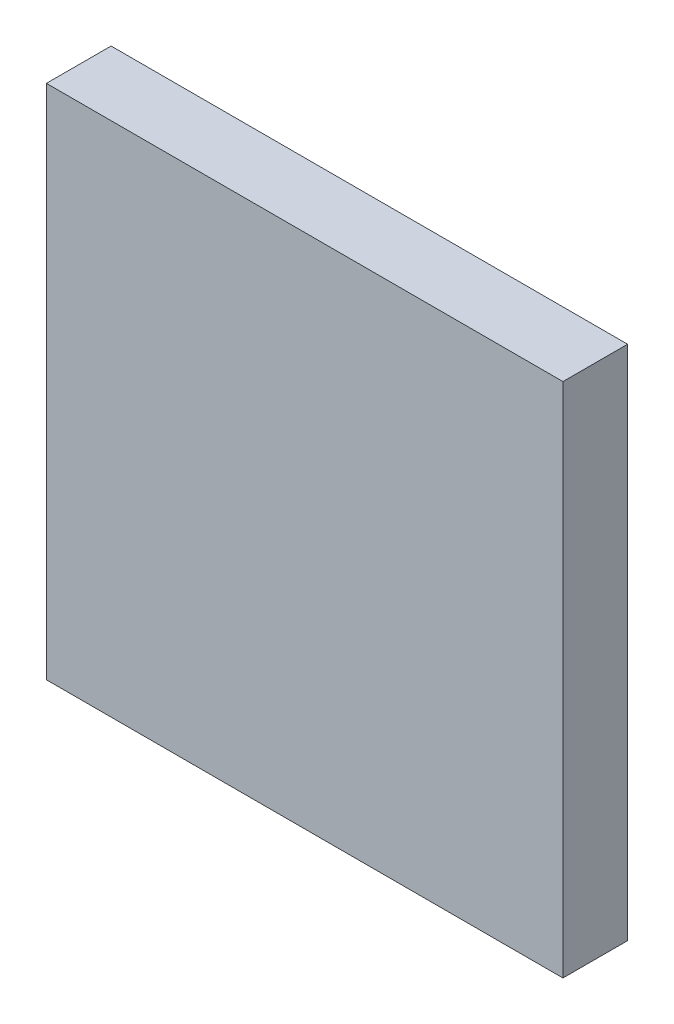
from build123d import *

# Parameters (mm, degrees)
SKETCH1_W           = 25.4
SKETCH1_H           = 25.4
BOSS_EXTRUDE1_DEPTH = 3.18


with BuildPart() as part:
    # Sketch1 → Boss-Extrude1 (new body)
    with BuildSketch(Plane.XY):
        Rectangle(SKETCH1_W, SKETCH1_H)
    extrude(amount=BOSS_EXTRUDE1_DEPTH)


solid = part.part
